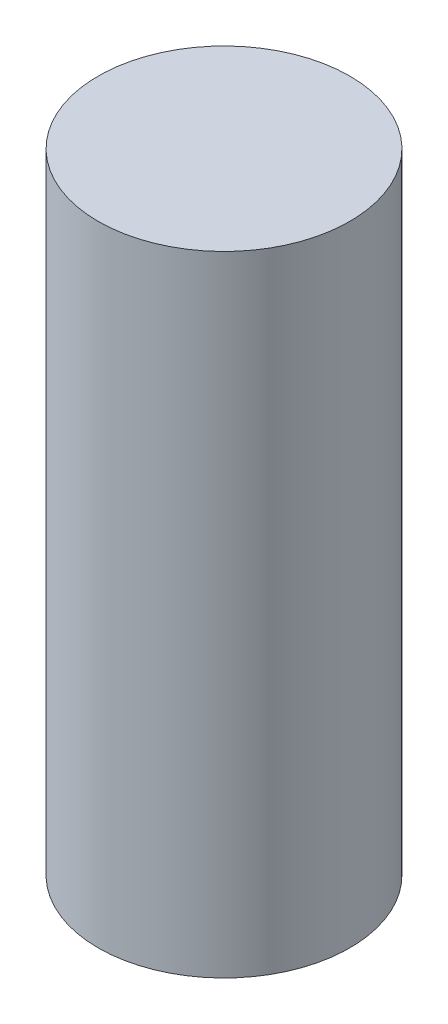
from build123d import *

# Parameters (mm, degrees)
SKETCH1_R           = 0.1
BOSS_EXTRUDE1_DEPTH = 0.5


with BuildPart() as part:
    # Sketch1 → Boss-Extrude1 (new body)
    with BuildSketch(Plane(origin=(0, 0, 0), x_dir=(1, 0, 0), z_dir=(0, 1, 0))):
        with Locations(Location((0, 0, 0), (0, 0, 270))):
            Circle(SKETCH1_R)
    extrude(amount=BOSS_EXTRUDE1_DEPTH)


solid = part.part
